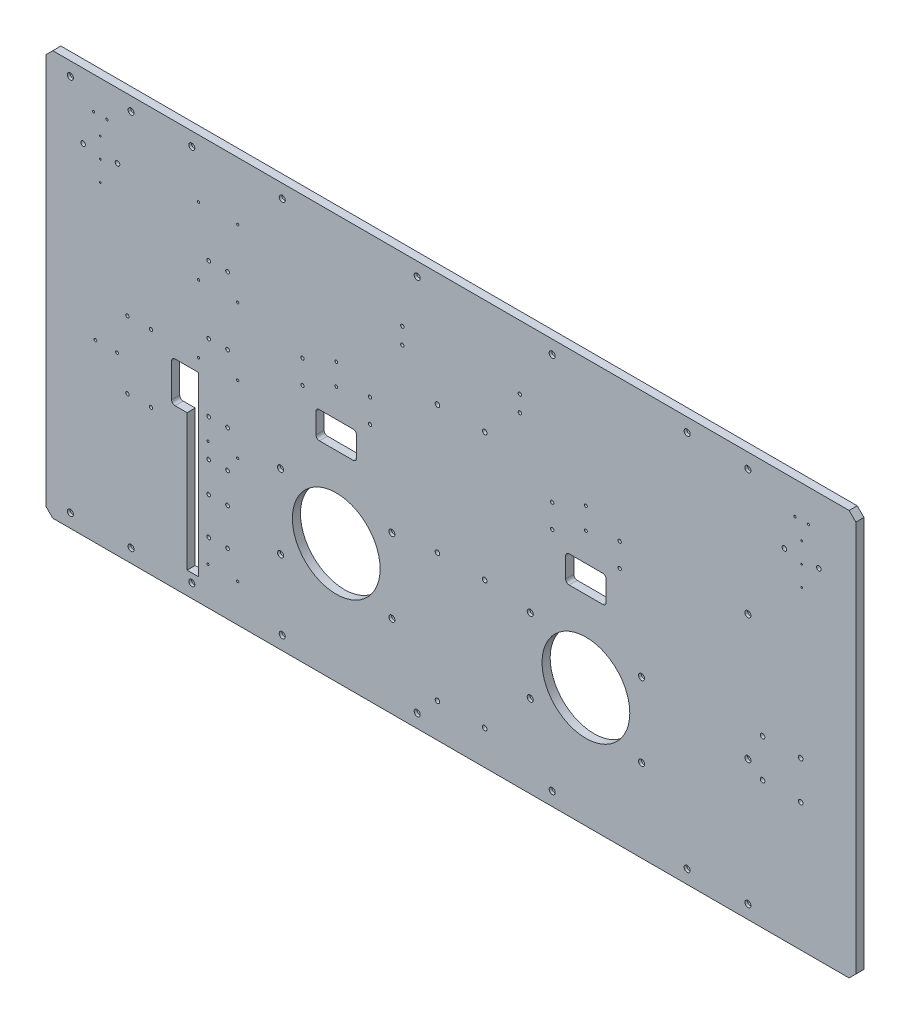
from build123d import *

# Parameters (mm, degrees)
BOSS_EXTRUDE1_DEPTH                             = 6
CUT_EXTRUDE1_REACH                              = 672.928
SKETCH2_R                                       = 65
BOSS_EXTRUDE2_DEPTH                             = 12
M8X1_25_TAPPED_HOLE1_D                          = 6.8
M4X0_7_TAPPED_HOLE1_D                           = 3.3
M6X1_0_TAPPED_HOLE1_D                           = 5
CBORE_FOR_M8_PAN_HEAD_SCREW1_D                  = 9
CBORE_FOR_M8_PAN_HEAD_SCREW1_CBORE_D            = 14
CBORE_FOR_M8_PAN_HEAD_SCREW1_CBORE_DEPTH        = 8
CBORE_FOR_M5_PAN_HEAD_SCREW1_D                  = 5.5
CBORE_FOR_M5_PAN_HEAD_SCREW1_CBORE_D            = 9.5
CBORE_FOR_M5_PAN_HEAD_SCREW1_CBORE_DEPTH        = 5
SKETCH21_W                                      = 17
SKETCH21_H                                      = 262.1
CUT_EXTRUDE2_DEPTH                              = 671.927715928
CBORE_FOR_M8_SOCKET_HEAD_CAP_SCREW2_D           = 9
CBORE_FOR_M8_SOCKET_HEAD_CAP_SCREW2_CBORE_D     = 15
CBORE_FOR_M8_SOCKET_HEAD_CAP_SCREW2_CBORE_DEPTH = 8
LPATTERN1_COUNT                                 = 2
LPATTERN1_PITCH                                 = 560
CBORE_FOR_M8_SOCKET_HEAD_CAP_SCREW3_D           = 9
CBORE_FOR_M8_SOCKET_HEAD_CAP_SCREW3_CBORE_D     = 15
CBORE_FOR_M8_SOCKET_HEAD_CAP_SCREW3_CBORE_DEPTH = 8
LPATTERN2_COUNT                                 = 4
LPATTERN2_PITCH                                 = 200
MIRROR1_COPY_1_D                                = 9
MIRROR1_COPY_1_CBORE_D                          = 15
MIRROR1_COPY_1_CBORE_DEPTH                      = 8
MIRROR1_COPY_2_D                                = 9
MIRROR1_COPY_2_CBORE_D                          = 15
MIRROR1_COPY_2_CBORE_DEPTH                      = 8
MIRROR1_COPY_3_D                                = 9
MIRROR1_COPY_3_CBORE_D                          = 15
MIRROR1_COPY_3_CBORE_DEPTH                      = 8
CBORE_FOR_M8_SOCKET_HEAD_CAP_SCREW4_D           = 9
CBORE_FOR_M8_SOCKET_HEAD_CAP_SCREW4_CBORE_D     = 15
CBORE_FOR_M8_SOCKET_HEAD_CAP_SCREW4_CBORE_DEPTH = 8
LPATTERN3_COUNT                                 = 4
LPATTERN3_PITCH                                 = 186
M3X0_5_TAPPED_HOLE1_D                           = 2.5
LPATTERN4_COUNT                                 = 3
LPATTERN4_PITCH                                 = 30
M5X0_8_TAPPED_HOLE1_D                           = 4.2
M8X1_25_TAPPED_HOLE2_D                          = 6.8
SKETCH45_W                                      = 5.088141025
SKETCH45_H                                      = 1.356837607
SKETCH45_W_2                                    = 5.088141026
CUT_EXTRUDE3_DEPTH                              = 0.01


with BuildPart() as part:
    # Sketch1 → Boss-Extrude1 (new, symmetric)
    with BuildSketch(Plane.XY):
        Polygon((-600, 290), (-590, 300), (590, 300), (600, 290), (600, -290), (590, -300), (-590, -300), (-600, -290), align=None)
    extrude(amount=BOSS_EXTRUDE1_DEPTH, both=True)

    # Sketch2 → Cut-Extrude1 (cut, up to next)
    with BuildSketch(Plane.XY.offset(6), mode=Mode.PRIVATE) as cut_extrude1_sk1:
        with Locations((-170, -122.5)):
            Circle(SKETCH2_R)
    cut_extrude1_tool1 = extrude(cut_extrude1_sk1.sketch, amount=-CUT_EXTRUDE1_REACH, mode=Mode.PRIVATE) & part.part
    # Sketch2 → Cut-Extrude1 (cut, up to next)
    with BuildSketch(Plane.XY.offset(6), mode=Mode.PRIVATE) as cut_extrude1_sk2:
        with Locations((200, -122.5)):
            Circle(SKETCH2_R)
    cut_extrude1_tool2 = extrude(cut_extrude1_sk2.sketch, amount=-CUT_EXTRUDE1_REACH, mode=Mode.PRIVATE) & part.part
    # Sketch2 → Cut-Extrude1 (cut, up to next)
    with BuildSketch(Plane.XY.offset(6), mode=Mode.PRIVATE) as cut_extrude1_sk3:
        with BuildLine():
            Line((-323.99999995, 230), (-303.99999995, 230))
            Line((-303.99999995, 230), (-303.99999995, -20))
            Line((-303.99999995, -20), (-318.99999995, -20))
            ThreePointArc((-318.99999995, -20), (-322.535533856, -18.535533906), (-323.99999995, -15))
            Line((-323.99999995, -15), (-323.99999995, 230))
        make_face()
    cut_extrude1_tool3 = extrude(cut_extrude1_sk3.sketch, amount=-CUT_EXTRUDE1_REACH, mode=Mode.PRIVATE) & part.part
    # Sketch2 → Cut-Extrude1 (cut, up to next)
    with BuildSketch(Plane.XY.offset(6), mode=Mode.PRIVATE) as cut_extrude1_sk4:
        with BuildLine():
            Line((175, 36.9), (225, 36.9))
            ThreePointArc((225, 36.9), (228.535533906, 35.435533906), (230, 31.9))
            Line((230, 31.9), (230, 1.9))
            ThreePointArc((230, 1.9), (228.535533906, -1.635533906), (225, -3.1))
            Line((225, -3.1), (175, -3.1))
            ThreePointArc((175, -3.1), (171.464466094, -1.635533906), (170, 1.9))
            Line((170, 1.9), (170, 31.9))
            ThreePointArc((170, 31.9), (171.464466094, 35.435533906), (175, 36.9))
        make_face()
    cut_extrude1_tool4 = extrude(cut_extrude1_sk4.sketch, amount=-CUT_EXTRUDE1_REACH, mode=Mode.PRIVATE) & part.part
    # Sketch2 → Cut-Extrude1 (cut, up to next)
    with BuildSketch(Plane.XY.offset(6), mode=Mode.PRIVATE) as cut_extrude1_sk5:
        with BuildLine():
            Line((-408.9, -5), (-385, -5))
            ThreePointArc((-385, -5), (-381.464466094, -6.464466094), (-380, -10))
            Line((-380, -10), (-380, -60))
            ThreePointArc((-380, -60), (-381.464466094, -63.535533906), (-385, -65))
            Line((-385, -65), (-408.9, -65))
            ThreePointArc((-408.9, -65), (-412.435533906, -63.535533906), (-413.9, -60))
            Line((-413.9, -60), (-413.9, -10))
            ThreePointArc((-413.9, -10), (-412.435533906, -6.464466094), (-408.9, -5))
        make_face()
    cut_extrude1_tool5 = extrude(cut_extrude1_sk5.sketch, amount=-CUT_EXTRUDE1_REACH, mode=Mode.PRIVATE) & part.part
    # Sketch2 → Cut-Extrude1 (cut, up to next)
    with BuildSketch(Plane.XY.offset(6), mode=Mode.PRIVATE) as cut_extrude1_sk6:
        with BuildLine():
            Line((-200, 31.9), (-200, 1.9))
            ThreePointArc((-200, 1.9), (-198.535533906, -1.635533906), (-195, -3.1))
            Line((-195, -3.1), (-145, -3.1))
            ThreePointArc((-145, -3.1), (-141.464466094, -1.635533906), (-140, 1.9))
            Line((-140, 1.9), (-140, 31.9))
            ThreePointArc((-140, 31.9), (-141.464466094, 35.435533906), (-145, 36.9))
            Line((-145, 36.9), (-195, 36.9))
            ThreePointArc((-195, 36.9), (-198.535533906, 35.435533906), (-200, 31.9))
        make_face()
    cut_extrude1_tool6 = extrude(cut_extrude1_sk6.sketch, amount=-CUT_EXTRUDE1_REACH, mode=Mode.PRIVATE) & part.part
    add(cut_extrude1_tool1.solids().sort_by_distance((-170, -122.5, 6))[0], mode=Mode.SUBTRACT)
    add(cut_extrude1_tool2.solids().sort_by_distance((200, -122.5, 6))[0], mode=Mode.SUBTRACT)
    add(cut_extrude1_tool3.solids().sort_by_distance((-313.990458, 105.133071, 6))[0], mode=Mode.SUBTRACT)
    add(cut_extrude1_tool4.solids().sort_by_distance((200, 16.9, 6))[0], mode=Mode.SUBTRACT)
    add(cut_extrude1_tool5.solids().sort_by_distance((-396.95, -35, 6))[0], mode=Mode.SUBTRACT)
    add(cut_extrude1_tool6.solids().sort_by_distance((-170, 16.9, 6))[0], mode=Mode.SUBTRACT)

    # Sketch20 → Boss-Extrude2 (add)
    with BuildSketch(Plane.XY.offset(6)):
        with BuildLine():
            Line((-303.99999995, -20), (-303.99999995, 230))
            Line((-303.99999995, 230), (-323.99999995, 230))
            Line((-323.99999995, 230), (-323.99999995, -15))
            ThreePointArc((-323.99999995, -15), (-322.535533856, -18.535533906), (-318.99999995, -20))
            Line((-318.99999995, -20), (-303.99999995, -20))
        make_face()
    extrude(amount=-BOSS_EXTRUDE2_DEPTH)

    # M8x1.25 Tapped Hole1 (through all)
    with Locations(Plane.XY.offset(6)):
        with Locations((-20, 130.77), (50, 130.77), (50, -59.23), (-20, -59.23), (-20, -249.23), (50, -249.23), (-494.1, 203.3), (-545.1, 203.3), (545.1, 203.3), (494.1, 203.3)):
            Hole(M8X1_25_TAPPED_HOLE1_D / 2)

    # M4x0.7 Tapped Hole1 (through all)
    with Locations(Plane(origin=(0, 0, -6), x_dir=(-1, 0, 0), z_dir=(0, 0, -1))):
        with Locations((-529.6, 251.9), (-509.6, 251.9), (509.6, 251.9), (529.6, 251.9), (316, -244), (360, -244.1), (374, 213.9), (316, 213.9), (316, -86.1), (360, -86.1), (316, 13.9), (374, 13.9), (374, 113.9), (316, 113.9)):
            Hole(M4X0_7_TAPPED_HOLE1_D / 2)

    # M6x1.0 Tapped Hole1 (through all)
    with Locations(Plane(origin=(0, 0, -6), x_dir=(-1, 0, 0), z_dir=(0, 0, -1))):
        with Locations((-102.1, 205.3), (120, 90.5), (120, 55.5), (220, 90.5), (220, 55.5), (-150, 90.5), (-150, 55.5), (-250, 55.5), (-250, 90.5), (479.4, -85), (479.4, 15), (444.4, 15), (444.4, -85), (72.1, 205.3), (-102.1, 181.3), (72.1, 181.3)):
            Hole(M6X1_0_TAPPED_HOLE1_D / 2)

    # CBORE for M8 Pan Head Screw1 (through all)
    with Locations(Plane(origin=(0, 0, -6), x_dir=(-1, 0, 0), z_dir=(0, 0, -1))):
        with Locations((-282.5, -177.5), (-117.5, -177.5), (-117.5, -67.5), (-282.5, -67.5), (87.5, -67.5), (252.5, -177.5), (252.5, -67.5), (87.5, -177.5)):
            CounterBoreHole(CBORE_FOR_M8_PAN_HEAD_SCREW1_D / 2, CBORE_FOR_M8_PAN_HEAD_SCREW1_CBORE_D / 2, CBORE_FOR_M8_PAN_HEAD_SCREW1_CBORE_DEPTH)

    # CBORE for M5 Pan Head Screw1 (through all)
    with Locations(Plane(origin=(0, 0, -6), x_dir=(-1, 0, 0), z_dir=(0, 0, -1))):
        with Locations((331, -209.1), (331, -154.1), (331, -54.1), (331, 45.9), (331, 145.9), (359, -209.1), (359, -154.1), (359, -54.1), (359, 45.9), (359, 145.9), (331, -109.1), (359, -109.1)):
            CounterBoreHole(CBORE_FOR_M5_PAN_HEAD_SCREW1_D / 2, CBORE_FOR_M5_PAN_HEAD_SCREW1_CBORE_D / 2, CBORE_FOR_M5_PAN_HEAD_SCREW1_CBORE_DEPTH)

    # Sketch21 → Cut-Extrude2 (cut, through all)
    with BuildSketch(Plane(origin=(0, 0, -6), x_dir=(-1, 0, 0), z_dir=(0, 0, -1))):
        with Locations((382.5, -136.05)):
            Rectangle(SKETCH21_W, SKETCH21_H)
    extrude(amount=-CUT_EXTRUDE2_DEPTH, mode=Mode.SUBTRACT)

    # CBORE for M8 Socket Head Cap Screw2 (through all)
    with Locations(Plane(origin=(0, 0, -6), x_dir=(-1, 0, 0), z_dir=(0, 0, -1))):
        with Locations((564, -280), (474, -280), (384, -280)):
            cbore_for_m8_socket_head_cap_screw2 = CounterBoreHole(CBORE_FOR_M8_SOCKET_HEAD_CAP_SCREW2_D / 2, CBORE_FOR_M8_SOCKET_HEAD_CAP_SCREW2_CBORE_D / 2, CBORE_FOR_M8_SOCKET_HEAD_CAP_SCREW2_CBORE_DEPTH)

    # LPattern1: CBORE for M8 Socket Head Cap Screw2 ×2
    with Locations(*[(0, i * LPATTERN1_PITCH, 0) for i in range(1, LPATTERN1_COUNT)]):
        add(cbore_for_m8_socket_head_cap_screw2, mode=Mode.SUBTRACT)

    # CBORE for M8 Socket Head Cap Screw3 (through all)
    with Locations(Plane(origin=(0, 0, -6), x_dir=(-1, 0, 0), z_dir=(0, 0, -1))):
        with Locations((250, -280)):
            cbore_for_m8_socket_head_cap_screw3 = CounterBoreHole(CBORE_FOR_M8_SOCKET_HEAD_CAP_SCREW3_D / 2, CBORE_FOR_M8_SOCKET_HEAD_CAP_SCREW3_CBORE_D / 2, CBORE_FOR_M8_SOCKET_HEAD_CAP_SCREW3_CBORE_DEPTH)

    # LPattern2: CBORE for M8 Socket Head Cap Screw3 ×4
    with Locations(*[(i * LPATTERN2_PITCH, 0, 0) for i in range(1, LPATTERN2_COUNT)]):
        add(cbore_for_m8_socket_head_cap_screw3, mode=Mode.SUBTRACT)

    # Mirror1: CBORE for M8 Socket Head Cap Screw3 across plane
    add(cbore_for_m8_socket_head_cap_screw3.mirror(Plane.ZX), mode=Mode.SUBTRACT)

    # Mirror1 copy 1 (through all)
    with Locations(Plane(origin=(200, 0, -6), x_dir=(-1, 0, 0), z_dir=(0, 0, -1))):
        with Locations((250, 280)):
            CounterBoreHole(MIRROR1_COPY_1_D / 2, MIRROR1_COPY_1_CBORE_D / 2, MIRROR1_COPY_1_CBORE_DEPTH)

    # Mirror1 copy 2 (through all)
    with Locations(Plane(origin=(400, 0, -6), x_dir=(-1, 0, 0), z_dir=(0, 0, -1))):
        with Locations((250, 280)):
            CounterBoreHole(MIRROR1_COPY_2_D / 2, MIRROR1_COPY_2_CBORE_D / 2, MIRROR1_COPY_2_CBORE_DEPTH)

    # Mirror1 copy 3 (through all)
    with Locations(Plane(origin=(600, 0, -6), x_dir=(-1, 0, 0), z_dir=(0, 0, -1))):
        with Locations((250, 280)):
            CounterBoreHole(MIRROR1_COPY_3_D / 2, MIRROR1_COPY_3_CBORE_D / 2, MIRROR1_COPY_3_CBORE_DEPTH)

    # CBORE for M8 Socket Head Cap Screw4 (through all)
    with Locations(Plane(origin=(0, 0, -6), x_dir=(-1, 0, 0), z_dir=(0, 0, -1))):
        with Locations((-440, -280)):
            cbore_for_m8_socket_head_cap_screw4 = CounterBoreHole(CBORE_FOR_M8_SOCKET_HEAD_CAP_SCREW4_D / 2, CBORE_FOR_M8_SOCKET_HEAD_CAP_SCREW4_CBORE_D / 2, CBORE_FOR_M8_SOCKET_HEAD_CAP_SCREW4_CBORE_DEPTH)

    # LPattern3: CBORE for M8 Socket Head Cap Screw4 ×4
    with Locations(*[(0, i * LPATTERN3_PITCH, 0) for i in range(1, LPATTERN3_COUNT)]):
        add(cbore_for_m8_socket_head_cap_screw4, mode=Mode.SUBTRACT)

    # M3x0.5 Tapped Hole1 (through all)
    with Locations(Plane(origin=(0, 0, -6), x_dir=(-1, 0, 0), z_dir=(0, 0, -1))):
        with Locations((519.6, 225.9), (-519.6, 225.9)):
            m3x0_5_tapped_hole1 = Hole(M3X0_5_TAPPED_HOLE1_D / 2)

    # LPattern4: M3x0.5 Tapped Hole1 ×3
    with Locations(*[(0, -i * LPATTERN4_PITCH, 0) for i in range(1, LPATTERN4_COUNT)]):
        add(m3x0_5_tapped_hole1, mode=Mode.SUBTRACT)

    # M5x0.8 Tapped Hole1 (through all)
    with Locations(Plane(origin=(0, 0, -6), x_dir=(-1, 0, 0), z_dir=(0, 0, -1))):
        with Locations((494.843466521, -39.859868954), (526.843466521, -39.859868954), (-200, 111), (-200, 79), (170, 111), (170, 79)):
            Hole(M5X0_8_TAPPED_HOLE1_D / 2)

    # M8x1.25 Tapped Hole2 (through all)
    with Locations(Plane(origin=(0, 0, -6), x_dir=(-1, 0, 0), z_dir=(0, 0, -1))):
        with Locations((-518.284271247, -110.284271247), (-461.715728753, -53.715728753), (-461.715728753, -110.284271247), (-518.284271247, -53.715728753)):
            Hole(M8X1_25_TAPPED_HOLE2_D / 2)

    # Sketch45 → Cut-Extrude3 (cut)
    # profile 1 of 14: a face of its own
    with BuildSketch(Plane(origin=(0, 0, -6), x_dir=(-1, 0, 0), z_dir=(0, 0, -1))):
        Polygon((-119.904833666, -276.437594854), (-119.904833666, -275.080757247), (-112.951040931, -275.080757247), (-112.951040931, -276.437594854), (-115.834320845, -276.437594854), (-115.834320845, -288.309923914), (-117.021553751, -288.309923914), (-117.021553751, -276.437594854), align=None)
    # profile 2 of 14: a face of its own
    with BuildSketch(Plane(origin=(0, 0, -6), x_dir=(-1, 0, 0), z_dir=(0, 0, -1))):
        with BuildLine():
            Line((-98.534641358, -277.338619828), (-99.552269563, -278.303246564))
            add(Edge.make_bspline(
                [(-99.552269563, -278.303246564), (-99.73641536, -278.130016814), (-100.100315893, -277.787688076), (-100.693588239, -277.343524493), (-101.312575784, -276.963030602), (-101.954048615, -276.65344453), (-102.602121125, -276.406426656), (-103.248191202, -276.230561364), (-103.885631799, -276.118406237), (-104.309597178, -276.104994246), (-104.51850721, -276.098385453)],
                knots=[0, 0, 0, 0, 1.08915593, 2.152340314, 3.188132944, 4.216796309, 5.218260357, 6.173443236, 7.099959455, 8, 8, 8, 8], degree=3))
            add(Edge.make_bspline(
                [(-104.51850721, -276.098385453), (-104.646696701, -276.099948784), (-104.902743217, -276.103071393), (-105.283070208, -276.142926017), (-105.65940839, -276.200245592), (-106.031047336, -276.283180665), (-106.398709639, -276.388292289), (-106.761116583, -276.519773058), (-107.118944203, -276.673062225), (-107.46882195, -276.850191218), (-107.808019687, -277.044772781), (-108.128380345, -277.260402681), (-108.431945871, -277.490169833), (-108.713010573, -277.739826809), (-108.97319119, -278.007112163), (-109.218680572, -278.287053826), (-109.440844756, -278.587300039), (-109.641516718, -278.902326661), (-109.820532359, -279.22660071), (-109.978559115, -279.557000999), (-110.111217752, -279.892431639), (-110.216179681, -280.233313539), (-110.302776498, -280.577009519), (-110.363697216, -280.925899385), (-110.398042862, -281.280356708), (-110.403983816, -281.517715393), (-110.406970418, -281.637038965)],
                knots=[0, 0, 0, 0, 1.02818874, 2.053710826, 3.065248034, 4.081641283, 5.106893873, 6.131558223, 7.173050175, 8.228653731, 9.27666206, 10.308777013, 11.325269123, 12.329503258, 13.32196095, 14.316845687, 15.314881793, 16.315733098, 17.311955233, 18.285320748, 19.252783886, 20.203351036, 21.145449891, 22.095197417, 23.042428769, 24, 24, 24, 24], degree=3))
            add(Edge.make_bspline(
                [(-110.406970418, -281.637038965), (-110.404113983, -281.75901497), (-110.398408912, -282.002633906), (-110.361895204, -282.366224597), (-110.294130724, -282.724415255), (-110.203538491, -283.0783829), (-110.090218146, -283.428733748), (-109.948958367, -283.77394889), (-109.781644936, -284.114015547), (-109.587982969, -284.445869635), (-109.375612497, -284.7691263), (-109.137702638, -285.073622112), (-108.884985551, -285.363411835), (-108.608254442, -285.6320613), (-108.316382958, -285.886756384), (-108.000650843, -286.120479934), (-107.667266543, -286.337733933), (-107.315721427, -286.535780301), (-106.949829958, -286.712705421), (-106.574663063, -286.870033837), (-106.189022213, -286.999601571), (-105.79493407, -287.105200952), (-105.39286843, -287.191758623), (-104.980784414, -287.247443891), (-104.561711975, -287.287852686), (-104.27921774, -287.290807213), (-104.136896633, -287.292295709)],
                knots=[0, 0, 0, 0, 0.93586088, 1.869166235, 2.799637598, 3.729985548, 4.670839027, 5.622275134, 6.589130586, 7.576015415, 8.568469353, 9.55398029, 10.53834874, 11.515998671, 12.510579167, 13.508179873, 14.527009472, 15.561807829, 16.601455013, 17.643573243, 18.680854198, 19.719860599, 20.772568776, 21.833555941, 22.908541556, 24, 24, 24, 24], degree=3))
            add(Edge.make_bspline(
                [(-104.136896633, -287.292295709), (-103.965377285, -287.288710316), (-103.628571179, -287.281669815), (-103.133473612, -287.226862174), (-102.657967958, -287.141262686), (-102.203390345, -287.015903493), (-101.769212796, -286.856005674), (-101.353843643, -286.663255255), (-100.960553147, -286.430259169), (-100.588159009, -286.167286516), (-100.245118457, -285.874298905), (-99.935729357, -285.55814278), (-99.664926466, -285.220352766), (-99.428673585, -284.86291839), (-99.233227183, -284.482881076), (-99.072803523, -284.082103236), (-98.949835427, -283.660404605), (-98.899356802, -283.369016592), (-98.87385076, -283.221782888)],
                knots=[0, 0, 0, 0, 1.13008108, 2.219097802, 3.278683437, 4.311054135, 5.322181354, 6.324827112, 7.324222904, 8.330512327, 9.32562643, 10.293043162, 11.24128371, 12.174520618, 13.111833804, 14.052305215, 15.015860969, 16, 16, 16, 16], degree=3))
            Line((-98.87385076, -283.221782888), (-103.283572982, -283.221782888))
            Line((-103.283572982, -283.221782888), (-103.283572982, -281.864945282))
            Line((-103.283572982, -281.864945282), (-97.686617854, -281.864945282))
            add(Edge.make_bspline(
                [(-97.686617854, -281.864945282), (-97.693065554, -282.117839659), (-97.705684869, -282.612799638), (-97.794202795, -283.334621793), (-97.937140207, -284.016383848), (-98.132403886, -284.658803791), (-98.385176523, -285.26097124), (-98.692745306, -285.82349758), (-99.060032787, -286.342748725), (-99.473956182, -286.822963708), (-99.938488761, -287.251321147), (-100.441078485, -287.627807877), (-100.982555717, -287.944939786), (-101.562408263, -288.202948838), (-102.178737877, -288.404311854), (-102.832970741, -288.547079421), (-103.524219649, -288.632615294), (-103.997962445, -288.64354402), (-104.240249498, -288.649133316)],
                knots=[0, 0, 0, 0, 1.140356446, 2.231883559, 3.274166699, 4.278491846, 5.25512956, 6.21435461, 7.1637429, 8.11826594, 9.068280886, 10.0076534, 10.945064095, 11.891975133, 12.864533718, 13.863980011, 14.907571808, 16, 16, 16, 16], degree=3))
            add(Edge.make_bspline(
                [(-104.240249498, -288.649133316), (-104.389588402, -288.646982173), (-104.684132853, -288.642739426), (-105.119149158, -288.612586952), (-105.542171117, -288.566169298), (-105.953137103, -288.496073147), (-106.353558813, -288.410217162), (-106.741436411, -288.300276291), (-107.11824746, -288.173016623), (-107.48457437, -288.028268096), (-107.837092151, -287.860553798), (-108.17737095, -287.674175101), (-108.507291723, -287.470093053), (-108.824607138, -287.244778249), (-109.130970529, -286.999915974), (-109.424406462, -286.735015447), (-109.706557667, -286.450886513), (-109.883301086, -286.249126566), (-109.972358372, -286.147463978)],
                knots=[0, 0, 0, 0, 1.107784379, 2.184907829, 3.233506516, 4.263428166, 5.276301166, 6.270063455, 7.25232949, 8.225834625, 9.190232166, 10.146266622, 11.1027726, 12.066435141, 13.031522626, 14.010570082, 14.99756817, 16, 16, 16, 16], degree=3))
            add(Edge.make_bspline(
                [(-109.972358372, -286.147463978), (-110.101573055, -285.98617907), (-110.357857591, -285.666286415), (-110.687748242, -285.153750911), (-110.96896783, -284.623065309), (-111.197143825, -284.072752279), (-111.375314568, -283.503326564), (-111.503094154, -282.91551579), (-111.577960991, -282.30856302), (-111.588746683, -281.897834192), (-111.594203324, -281.690040434)],
                knots=[0, 0, 0, 0, 1.023165419, 2.029347347, 3.013907458, 3.994755782, 4.975994455, 5.96558838, 6.970761222, 8, 8, 8, 8], degree=3))
            add(Edge.make_bspline(
                [(-111.594203324, -281.690040434), (-111.59219159, -281.5344418), (-111.588193691, -281.225222096), (-111.539716294, -280.766142393), (-111.470163315, -280.315214181), (-111.367931889, -279.872806067), (-111.239056126, -279.43862258), (-111.078214081, -279.012462121), (-110.89094617, -278.594073202), (-110.673286706, -278.186335665), (-110.431062707, -277.794660057), (-110.168179434, -277.420623122), (-109.880903921, -277.071036477), (-109.573927536, -276.741472807), (-109.243587722, -276.436072403), (-108.892979186, -276.152007759), (-108.521831729, -275.88889783), (-108.128977716, -275.650886848), (-107.720280813, -275.43708983), (-107.296720689, -275.249654416), (-106.858426638, -275.094747242), (-106.408682303, -274.963310634), (-105.944083417, -274.866113526), (-105.468001477, -274.795625708), (-104.977954923, -274.74739368), (-104.646711597, -274.743514677), (-104.478756108, -274.741547846)],
                knots=[0, 0, 0, 0, 1.008945113, 2.00506715, 2.99143336, 3.967273523, 4.948097931, 5.927297278, 6.919902385, 7.919676788, 8.923139349, 9.905703106, 10.883022732, 11.856032218, 12.825136022, 13.798837087, 14.781400844, 15.773989409, 16.776158564, 17.77167057, 18.775803737, 19.789618931, 20.80898985, 21.851988756, 22.910860228, 24, 24, 24, 24], degree=3))
            add(Edge.make_bspline(
                [(-104.478756108, -274.741547846), (-104.341784175, -274.743738187), (-104.070184928, -274.748081375), (-103.666031119, -274.778185848), (-103.268124188, -274.825901113), (-102.875874143, -274.891014265), (-102.490616747, -274.979701429), (-102.111254497, -275.085830659), (-101.737237471, -275.209397965), (-101.369737838, -275.356766521), (-101.006284566, -275.524034686), (-100.644856776, -275.712317563), (-100.286689388, -275.924834693), (-99.931161274, -276.162217104), (-99.576030502, -276.420387761), (-99.226914145, -276.706730517), (-98.875385159, -277.009953434), (-98.64934854, -277.227978355), (-98.534641358, -277.338619828)],
                knots=[0, 0, 0, 0, 0.985871117, 1.954866573, 2.915460327, 3.869826059, 4.81536089, 5.759505086, 6.70452669, 7.649098992, 8.607881297, 9.583363685, 10.581137262, 11.603961102, 12.659522466, 13.73993555, 14.853081303, 16, 16, 16, 16], degree=3))
        make_face()
    # profile 3 of 14: a face of its own
    with BuildSketch(Plane(origin=(0, 0, -6), x_dir=(-1, 0, 0), z_dir=(0, 0, -1))):
        Polygon((-95.651361443, -288.309923914), (-93.904963039, -275.080757247), (-93.735358338, -275.080757247), (-88.273556956, -285.935458102), (-82.825005941, -275.080757247), (-82.652751167, -275.080757247), (-80.895752469, -288.309923914), (-82.088285522, -288.309923914), (-83.355020631, -278.790860079), (-88.13045299, -288.309923914), (-88.398110408, -288.309923914), (-93.192093281, -278.769659491), (-94.456178317, -288.309923914), align=None)
    # profile 4 of 14: a face of its own
    with BuildSketch(Plane(origin=(0, 0, -6), x_dir=(-1, 0, 0), z_dir=(0, 0, -1))):
        with Locations((-76.825239649, -283.221782889)):
            Rectangle(SKETCH45_W, SKETCH45_H)
    # profile 5 of 14: a face of its own
    with BuildSketch(Plane(origin=(0, 0, -6), x_dir=(-1, 0, 0), z_dir=(0, 0, -1))):
        with BuildLine():
            add(Edge.make_bspline(
                [(-73.263540931, -281.700640728), (-73.2623011, -281.488605959), (-73.259892711, -281.076725363), (-73.233100168, -280.476557222), (-73.188592178, -279.913522797), (-73.12759675, -279.387595136), (-73.053369861, -278.898638467), (-72.954281563, -278.447959474), (-72.841596268, -278.03347227), (-72.710996249, -277.653825242), (-72.56363169, -277.303903567), (-72.403240288, -276.977236883), (-72.22345669, -276.674319461), (-72.034555858, -276.390316503), (-71.828891182, -276.129876942), (-71.612315397, -275.889322831), (-71.376375567, -275.674213744), (-71.129092173, -275.478247066), (-70.86822637, -275.306458884), (-70.601213912, -275.155144664), (-70.326216934, -275.025877308), (-70.042484636, -274.924237863), (-69.752567229, -274.840286151), (-69.455451233, -274.782875545), (-69.150646078, -274.746752706), (-68.944908214, -274.74329926), (-68.840568341, -274.741547846)],
                knots=[0, 0, 0, 0, 1.646270934, 3.197905019, 4.663502075, 6.030701355, 7.308322542, 8.50163776, 9.611534131, 10.641858119, 11.616356847, 12.558055219, 13.465016945, 14.349605745, 15.204443733, 16.039544428, 16.859896111, 17.680448484, 18.487036065, 19.28249412, 20.06191084, 20.843045899, 21.620316918, 22.403196591, 23.190181807, 24, 24, 24, 24], degree=3))
            add(Edge.make_bspline(
                [(-68.840568341, -274.741547846), (-68.73535686, -274.743391671), (-68.526124326, -274.747058459), (-68.216787194, -274.782300742), (-67.914596432, -274.840777904), (-67.620840372, -274.923633968), (-67.333106049, -275.026427151), (-67.053644032, -275.155268338), (-66.780718455, -275.305245009), (-66.518666476, -275.481472164), (-66.264611233, -275.677952791), (-66.02479304, -275.900061688), (-65.799190066, -276.145556163), (-65.584970906, -276.411809637), (-65.388213143, -276.703928856), (-65.200837372, -277.016833081), (-65.033121641, -277.355994385), (-64.871594744, -277.715753892), (-64.732170717, -278.106065935), (-64.60643223, -278.524730357), (-64.504836129, -278.976692314), (-64.42021001, -279.459580503), (-64.354650433, -279.975168311), (-64.306902054, -280.522350516), (-64.281679381, -281.101487111), (-64.27692935, -281.497446839), (-64.274491785, -281.700640728)],
                knots=[0, 0, 0, 0, 0.810914788, 1.612654377, 2.396697861, 3.181598691, 3.963628158, 4.749916497, 5.551656086, 6.361998678, 7.18212741, 8.025565596, 8.878627764, 9.750805457, 10.657531673, 11.591944965, 12.560506719, 13.57287815, 14.630710178, 15.753379473, 16.941251878, 18.199788006, 19.531962791, 20.947069417, 22.433333509, 24, 24, 24, 24], degree=3))
            add(Edge.make_bspline(
                [(-64.274491785, -281.700640728), (-64.27695462, -281.902948356), (-64.281753352, -282.297136519), (-64.306619297, -282.873667289), (-64.355599838, -283.417945607), (-64.416869734, -283.93127682), (-64.501729029, -284.411524367), (-64.606069984, -284.86035011), (-64.721920907, -285.279692285), (-64.864927421, -285.666115532), (-65.021450046, -286.025010437), (-65.19174796, -286.360151146), (-65.37419641, -286.674499931), (-65.572969345, -286.965540641), (-65.784837901, -287.23533497), (-66.014336686, -287.479120627), (-66.254996338, -287.702771679), (-66.509799219, -287.901782294), (-66.775938118, -288.075971883), (-67.047926296, -288.231750425), (-67.330589679, -288.3573621), (-67.617522566, -288.46521776), (-67.912829188, -288.547618278), (-68.216141438, -288.604593863), (-68.525916497, -288.644552933), (-68.735321222, -288.647601235), (-68.840568341, -288.649133316)],
                knots=[0, 0, 0, 0, 1.561518951, 3.042555995, 4.452378317, 5.7783523, 7.031515105, 8.214008947, 9.334062868, 10.386615937, 11.391082383, 12.354592575, 13.286541444, 14.194233754, 15.072674879, 15.931287219, 16.775624067, 17.606195743, 18.42308326, 19.229000347, 20.022332153, 20.807536673, 21.593273796, 22.3848459, 23.188221202, 24, 24, 24, 24], degree=3))
            add(Edge.make_bspline(
                [(-68.840568341, -288.649133316), (-68.94490532, -288.647370603), (-69.150637476, -288.643894878), (-69.455484441, -288.607935238), (-69.751373438, -288.550121878), (-70.039764562, -288.469172214), (-70.322137402, -288.370086374), (-70.5946442, -288.240993582), (-70.860314909, -288.092320166), (-71.118440731, -287.923004139), (-71.36417122, -287.729020396), (-71.598889163, -287.5144649), (-71.816698015, -287.273983554), (-72.019422127, -287.011373547), (-72.212092043, -286.729050875), (-72.38932271, -286.423160894), (-72.553254212, -286.094916503), (-72.703097168, -285.742197019), (-72.835950747, -285.359855476), (-72.953303692, -284.943517807), (-73.04596137, -284.489509302), (-73.125271946, -284.001476396), (-73.189242084, -283.477321957), (-73.232914682, -282.916761426), (-73.259907153, -282.320144119), (-73.262307568, -281.910910151), (-73.263540931, -281.700640728)],
                knots=[0, 0, 0, 0, 0.810891512, 1.598919785, 2.382837074, 3.152667961, 3.926044502, 4.706494248, 5.493654104, 6.291793342, 7.103789334, 7.925228297, 8.761435821, 9.622817696, 10.50288917, 11.416980706, 12.369136599, 13.353924996, 14.394355917, 15.514179734, 16.714354668, 17.994756427, 19.357759367, 20.818452758, 22.365282078, 24, 24, 24, 24], degree=3))
        make_face()
        with BuildLine():
            add(Edge.make_bspline(
                [(-72.076308025, -281.695340581), (-72.075856543, -281.872039532), (-72.074980306, -282.214977499), (-72.05208931, -282.713313634), (-72.020905397, -283.178112198), (-71.980683828, -283.609963363), (-71.920952445, -284.007405374), (-71.854025003, -284.373171736), (-71.772578355, -284.705326769), (-71.676213257, -285.006149744), (-71.566452385, -285.280745925), (-71.446611769, -285.536262423), (-71.317870347, -285.775717659), (-71.173789033, -285.996960762), (-71.016871979, -286.200713228), (-70.850663529, -286.390581374), (-70.668960607, -286.559903297), (-70.417592294, -286.762978017), (-70.085742525, -286.972827124), (-69.667623542, -287.155563832), (-69.237983861, -287.270402284), (-68.946370505, -287.285006361), (-68.800817239, -287.292295709)],
                knots=[0, 0, 0, 0, 1.459021318, 2.831673884, 4.118529203, 5.306027144, 6.411944654, 7.436330062, 8.375795394, 9.233974572, 10.042671642, 10.816086306, 11.563610507, 12.285937304, 12.993564865, 13.685989202, 14.367179055, 15.041617293, 16.353048772, 17.594441528, 18.799311195, 20, 20, 20, 20], degree=3))
            add(Edge.make_bspline(
                [(-68.800817239, -287.292295709), (-68.654322468, -287.286256478), (-68.361635384, -287.274190485), (-67.934016575, -287.15777859), (-67.518884304, -286.982134795), (-67.193552863, -286.774446308), (-66.94604444, -286.576657681), (-66.768709388, -286.408024933), (-66.605945098, -286.219203649), (-66.451571779, -286.015477144), (-66.309985392, -285.792953171), (-66.181234841, -285.55270177), (-66.063747189, -285.29405577), (-65.996811211, -285.11349753), (-65.962588573, -285.021182762)],
                knots=[0, 0, 0, 0, 1.353760809, 2.704726607, 4.075137775, 5.516104923, 6.260822281, 7.007110065, 7.778089737, 8.566572457, 9.372053459, 10.217411131, 11.088608312, 12, 12, 12, 12], degree=3))
            add(Edge.make_bspline(
                [(-65.962588573, -285.021182762), (-65.922705404, -284.903141782), (-65.841725464, -284.663467971), (-65.737359532, -284.291676786), (-65.6551671, -283.90159491), (-65.581222236, -283.495553546), (-65.530750864, -283.070558248), (-65.490126689, -282.627923999), (-65.466198199, -282.167317065), (-65.463232027, -281.854371711), (-65.461724691, -281.695340581)],
                knots=[0, 0, 0, 0, 0.884706709, 1.796334032, 2.740027952, 3.714592787, 4.726048262, 5.777819803, 6.87074269, 8, 8, 8, 8], degree=3))
            add(Edge.make_bspline(
                [(-65.461724691, -281.695340581), (-65.463804276, -281.536335173), (-65.467872387, -281.225286603), (-65.483422281, -280.769756575), (-65.523576863, -280.337095693), (-65.568174723, -279.925440038), (-65.633932077, -279.537068358), (-65.704832121, -279.168729406), (-65.800086703, -278.824986426), (-65.901837043, -278.50045765), (-66.018293002, -278.198830176), (-66.146486402, -277.918697709), (-66.283396026, -277.658707827), (-66.432100328, -277.419573852), (-66.590834011, -277.200224657), (-66.763786652, -277.005058183), (-66.944097823, -276.828025595), (-67.196650877, -276.625949813), (-67.527282865, -276.419908583), (-67.938693496, -276.230293955), (-68.366829562, -276.121405468), (-68.656258987, -276.106053258), (-68.800817239, -276.098385453)],
                knots=[0, 0, 0, 0, 1.31362396, 2.569729283, 3.763502607, 4.902122613, 5.988968491, 7.01645872, 7.998833611, 8.933434873, 9.825090667, 10.667526885, 11.477055099, 12.250526234, 12.991942729, 13.710640831, 14.402115721, 15.076753259, 16.378508321, 17.609869233, 18.806226677, 20, 20, 20, 20], degree=3))
            add(Edge.make_bspline(
                [(-68.800817239, -276.098385453), (-68.947134061, -276.106063837), (-69.240034257, -276.121434595), (-69.672620277, -276.229888262), (-70.087276606, -276.418925365), (-70.417034278, -276.626632249), (-70.669763471, -276.824458605), (-70.847724842, -276.996008595), (-71.014586862, -277.183659616), (-71.168301086, -277.389285901), (-71.312269507, -277.610271069), (-71.444489406, -277.848353602), (-71.563617408, -278.104740009), (-71.67355003, -278.379212845), (-71.77020908, -278.680009867), (-71.849939238, -279.011755766), (-71.923595659, -279.37635875), (-71.975738491, -279.775953318), (-72.022092568, -280.207912648), (-72.051882187, -280.673871559), (-72.07505688, -281.173043473), (-72.075882624, -281.517754578), (-72.076308025, -281.695340581)],
                knots=[0, 0, 0, 0, 1.207732386, 2.417664972, 3.655092373, 4.956220595, 5.625982001, 6.301752483, 6.994047911, 7.697131622, 8.419323945, 9.170223765, 9.943494443, 10.752040957, 11.610060368, 12.549350801, 13.567764191, 14.679664412, 15.874934091, 17.154273443, 18.533957287, 20, 20, 20, 20], degree=3))
        make_face(mode=Mode.SUBTRACT)
    # profile 6 of 14: a face of its own
    with BuildSketch(Plane(origin=(0, 0, -6), x_dir=(-1, 0, 0), z_dir=(0, 0, -1))):
        with BuildLine():
            Line((-61.391211871, -278.133641863), (-62.578444777, -278.133641863))
            add(Edge.make_bspline(
                [(-62.578444777, -278.133641863), (-62.546280701, -278.000471462), (-62.483402564, -277.740134221), (-62.352253998, -277.368178205), (-62.209381813, -277.016193467), (-62.037821805, -276.690770807), (-61.850690502, -276.385370193), (-61.63629212, -276.106918443), (-61.404518168, -275.848333722), (-61.148156009, -275.618852139), (-60.879306603, -275.411049413), (-60.594181701, -275.233872857), (-60.298517788, -275.08145716), (-59.990266362, -274.955892593), (-59.668509702, -274.861302072), (-59.336156661, -274.79267367), (-58.992336289, -274.748106066), (-58.758945098, -274.743756455), (-58.640435629, -274.741547846)],
                knots=[0, 0, 0, 0, 1.162005537, 2.271625781, 3.343758855, 4.383309926, 5.390229558, 6.379919256, 7.361854164, 8.333198761, 9.295911338, 10.242430842, 11.177959212, 12.116337295, 13.062827104, 14.020064771, 14.994644689, 16, 16, 16, 16], degree=3))
            add(Edge.make_bspline(
                [(-58.640435629, -274.741547846), (-58.467765741, -274.746761008), (-58.126192396, -274.757073617), (-57.624379688, -274.851244255), (-57.140468795, -275.000261869), (-56.679756459, -275.206159587), (-56.251817741, -275.460111634), (-55.87105894, -275.7623593), (-55.542641057, -276.107070946), (-55.267117665, -276.487816055), (-55.051387758, -276.894728248), (-54.892311287, -277.313526461), (-54.795467433, -277.743217246), (-54.782916519, -278.033341486), (-54.776628537, -278.178693111)],
                knots=[0, 0, 0, 0, 1.083050992, 2.142477498, 3.193116406, 4.255571735, 5.30263384, 6.308962982, 7.297363603, 8.282367274, 9.249857812, 10.179914175, 11.08814088, 12, 12, 12, 12], degree=3))
            add(Edge.make_bspline(
                [(-54.776628537, -278.178693111), (-54.781026635, -278.318569984), (-54.789633028, -278.592287318), (-54.862709832, -278.991889406), (-54.985689159, -279.36851093), (-55.15604213, -279.723737347), (-55.376559299, -280.055316354), (-55.643685267, -280.363993978), (-55.959305447, -280.651139307), (-56.198484766, -280.815632554), (-56.321621359, -280.900318546)],
                knots=[0, 0, 0, 0, 1.024540389, 2.004866551, 2.965041327, 3.920577974, 4.882998113, 5.874504559, 6.905732034, 8, 8, 8, 8], degree=3))
            add(Edge.make_bspline(
                [(-56.321621359, -280.900318546), (-56.180894192, -280.968271753), (-55.90207297, -281.102906712), (-55.522015909, -281.366944843), (-55.177007273, -281.671806632), (-54.984603336, -281.909714874), (-54.887931622, -282.029249836)],
                knots=[0, 0, 0, 0, 1.015518401, 2.012035669, 3.001164323, 4, 4, 4, 4], degree=3))
            add(Edge.make_bspline(
                [(-54.887931622, -282.029249836), (-54.824275358, -282.116402647), (-54.698005245, -282.289281081), (-54.542144745, -282.567231263), (-54.4007472, -282.848262189), (-54.290566312, -283.139906373), (-54.20524247, -283.438783538), (-54.14425211, -283.74540688), (-54.106363244, -284.060026786), (-54.100937199, -284.272874554), (-54.098209734, -284.379864986)],
                knots=[0, 0, 0, 0, 1.025084078, 2.033381695, 3.024893161, 4.013698104, 4.991890475, 5.976764909, 6.982997093, 8, 8, 8, 8], degree=3))
            add(Edge.make_bspline(
                [(-54.098209734, -284.379864986), (-54.104992568, -284.565110064), (-54.118526315, -284.934728452), (-54.239494096, -285.480808501), (-54.427020333, -286.014607274), (-54.693330776, -286.525158006), (-55.017889515, -287.002845755), (-55.404019877, -287.430247281), (-55.847334575, -287.797634862), (-56.341748784, -288.104590189), (-56.877405787, -288.349964478), (-57.450325436, -288.520270884), (-58.052252723, -288.631191776), (-58.465030306, -288.643086191), (-58.674886584, -288.649133316)],
                knots=[0, 0, 0, 0, 0.955779014, 1.907060117, 2.875433937, 3.871313158, 4.872415639, 5.851225146, 6.836215519, 7.83643374, 8.849228613, 9.86973379, 10.916971861, 12, 12, 12, 12], degree=3))
            add(Edge.make_bspline(
                [(-58.674886584, -288.649133316), (-58.816322629, -288.645851676), (-59.094621604, -288.639394504), (-59.503756255, -288.595252172), (-59.894287679, -288.514629831), (-60.266743897, -288.406138171), (-60.62145579, -288.268586051), (-60.95734095, -288.097292162), (-61.276465845, -287.895787378), (-61.575819023, -287.661693162), (-61.8553648, -287.399826193), (-62.107674204, -287.105537673), (-62.336953779, -286.784267724), (-62.537064348, -286.432284744), (-62.717120686, -286.054137492), (-62.865215374, -285.644983941), (-62.995562612, -285.208481834), (-63.05616529, -284.904295138), (-63.087258879, -284.748225196)],
                knots=[0, 0, 0, 0, 1.048658725, 2.063410685, 3.046034179, 4.001477787, 4.936774919, 5.862367409, 6.792675028, 7.730719943, 8.675894397, 9.627829632, 10.600096036, 11.597688215, 12.626045268, 13.701542398, 14.82072376, 16, 16, 16, 16], degree=3))
            Line((-63.087258879, -284.748225196), (-61.900025973, -284.748225196))
            add(Edge.make_bspline(
                [(-61.900025973, -284.748225196), (-61.86909508, -284.85008605), (-61.808931806, -285.048214258), (-61.70652181, -285.333360652), (-61.589847092, -285.594761627), (-61.464681944, -285.834334736), (-61.333227699, -286.054439353), (-61.186138547, -286.249255346), (-61.034308743, -286.427339592), (-60.919859997, -286.527671905), (-60.863847254, -286.576775877)],
                knots=[0, 0, 0, 0, 1.198163088, 2.33053128, 3.407730985, 4.417276592, 5.372219308, 6.28897303, 7.162600585, 8, 8, 8, 8], degree=3))
            add(Edge.make_bspline(
                [(-60.863847254, -286.576775877), (-60.789776861, -286.633881782), (-60.641864712, -286.747917319), (-60.400835982, -286.893444308), (-60.14734668, -287.01954104), (-59.87590431, -287.115863343), (-59.592366339, -287.197421763), (-59.292149809, -287.250793963), (-58.977903364, -287.287412944), (-58.763334734, -287.290644382), (-58.653685996, -287.292295709)],
                knots=[0, 0, 0, 0, 0.946170439, 1.889420265, 2.845303464, 3.807233317, 4.801018734, 5.828864929, 6.890507805, 8, 8, 8, 8], degree=3))
            add(Edge.make_bspline(
                [(-58.653685996, -287.292295709), (-58.529885554, -287.289967734), (-58.287804478, -287.285415579), (-57.934567361, -287.243552044), (-57.598518378, -287.182582922), (-57.283388569, -287.088417779), (-56.985050044, -286.972073489), (-56.707684881, -286.825991719), (-56.447651979, -286.654599467), (-56.208281905, -286.459793719), (-55.993041445, -286.246533901), (-55.803526023, -286.023478543), (-55.642414951, -285.791568116), (-55.512453212, -285.549519266), (-55.409830597, -285.298334323), (-55.339968499, -285.037308391), (-55.291392832, -284.768577653), (-55.287436887, -284.585905657), (-55.28544264, -284.493818145)],
                knots=[0, 0, 0, 0, 1.217147791, 2.380027433, 3.494444702, 4.572153297, 5.609568379, 6.639424714, 7.649109417, 8.668170816, 9.669597737, 10.625200337, 11.543417969, 12.441394052, 13.322311151, 14.205496177, 15.095365482, 16, 16, 16, 16], degree=3))
            add(Edge.make_bspline(
                [(-55.28544264, -284.493818145), (-55.291226815, -284.370555049), (-55.302766385, -284.124642196), (-55.390867266, -283.762852555), (-55.535779044, -283.414270014), (-55.738648358, -283.084841879), (-55.985601856, -282.779528203), (-56.274243022, -282.50711516), (-56.606968766, -282.282332375), (-56.91320458, -282.127027037), (-57.184459785, -282.021053568), (-57.416595315, -281.950466649), (-57.676478905, -281.890694796), (-57.960967784, -281.835085912), (-58.272205536, -281.787758197), (-58.609853323, -281.74829062), (-58.973979564, -281.716710555), (-59.226056293, -281.702607903), (-59.35595546, -281.695340581)],
                knots=[0, 0, 0, 0, 1.07054697, 2.135767047, 3.216561865, 4.33974944, 5.486079747, 6.621378074, 7.775625952, 8.963672916, 9.598146892, 10.304877434, 11.070270905, 11.915000392, 12.823868403, 13.805723172, 14.86925407, 16, 16, 16, 16], degree=3))
            Line((-59.35595546, -281.695340581), (-59.35595546, -280.338502974))
            add(Edge.make_bspline(
                [(-59.35595546, -280.338502974), (-59.192287364, -280.335725591), (-58.871701768, -280.33028538), (-58.403410795, -280.264487245), (-57.955609883, -280.173468204), (-57.53822309, -280.03405096), (-57.157794918, -279.872124838), (-56.827747612, -279.683695355), (-56.552705121, -279.474240797), (-56.334004047, -279.240528256), (-56.169473927, -278.989873166), (-56.049176211, -278.728628656), (-55.978115454, -278.454504973), (-55.96862951, -278.267426913), (-55.963861443, -278.173392965)],
                knots=[0, 0, 0, 0, 1.321986639, 2.589447074, 3.816329219, 5.01088745, 6.139805852, 7.153945165, 8.075214402, 8.924034688, 9.728124013, 10.488707548, 11.240355623, 12, 12, 12, 12], degree=3))
            add(Edge.make_bspline(
                [(-55.963861443, -278.173392965), (-55.965427818, -278.10430744), (-55.968544046, -277.966865065), (-56.007843281, -277.766064954), (-56.066898436, -277.57140364), (-56.148086698, -277.383708941), (-56.256755604, -277.204282608), (-56.386802041, -277.031594929), (-56.541651706, -276.866631836), (-56.719094318, -276.712869914), (-56.909638938, -276.566331428), (-57.118469933, -276.441925717), (-57.33929071, -276.335544083), (-57.572345744, -276.247817691), (-57.81839135, -276.181825739), (-58.076271494, -276.134443243), (-58.346477916, -276.104818774), (-58.530823451, -276.100553631), (-58.624535188, -276.098385453)],
                knots=[0, 0, 0, 0, 0.884392785, 1.759457502, 2.611959086, 3.489218968, 4.37281399, 5.2945488, 6.255912374, 7.266815255, 8.301784654, 9.332968512, 10.37626691, 11.440494194, 12.520033166, 13.637162961, 14.798855837, 16, 16, 16, 16], degree=3))
            add(Edge.make_bspline(
                [(-58.624535188, -276.098385453), (-58.775165005, -276.10364447), (-59.06938007, -276.113916553), (-59.493525738, -276.203886277), (-59.887827983, -276.34743439), (-60.189221157, -276.51878241), (-60.411783268, -276.687928395), (-60.570824076, -276.83565051), (-60.727005767, -276.999816242), (-60.870053415, -277.190536887), (-61.014719934, -277.394896481), (-61.14642408, -277.62328361), (-61.274405655, -277.869740696), (-61.351522434, -278.043971219), (-61.391211871, -278.133641863)],
                knots=[0, 0, 0, 0, 1.472543308, 2.876219568, 4.221790263, 5.565193594, 6.249813518, 6.953379497, 7.687249741, 8.463570142, 9.283606569, 10.136032583, 11.040678096, 12, 12, 12, 12], degree=3))
        make_face()
    # profile 7 of 14: a face of its own
    with BuildSketch(Plane(origin=(0, 0, -6), x_dir=(-1, 0, 0), z_dir=(0, 0, -1))):
        with Locations((-50.366906315, -283.221782889)):
            Rectangle(SKETCH45_W_2, SKETCH45_H)
    # profile 8 of 14: a face of its own
    with BuildSketch(Plane(origin=(0, 0, -6), x_dir=(-1, 0, 0), z_dir=(0, 0, -1))):
        Polygon((-43.993479666, -275.080757247), (-41.547461871, -275.080757247), (-41.547461871, -288.309923914), (-42.734694777, -288.309923914), (-42.734694777, -276.437594854), (-44.769951187, -276.437594854), align=None)
    # profile 9 of 14: a face of its own
    with BuildSketch(Plane(origin=(0, 0, -6), x_dir=(-1, 0, 0), z_dir=(0, 0, -1))):
        Polygon((-29.407475392, -274.741547846), (-29.166318708, -274.741547846), (-29.166318708, -283.900201692), (-27.639876401, -283.900201692), (-27.639876401, -285.257039299), (-29.166318708, -285.257039299), (-29.166318708, -288.309923914), (-30.353551614, -288.309923914), (-30.353551614, -285.257039299), (-36.628925546, -285.257039299), align=None)
        Polygon((-30.353551614, -283.900201692), (-30.353551614, -278.15484245), (-34.296860909, -283.900201692), align=None, mode=Mode.SUBTRACT)
    # profile 10 of 14: a face of its own
    with BuildSketch(Plane(origin=(0, 0, -6), x_dir=(-1, 0, 0), z_dir=(0, 0, -1))):
        with BuildLine():
            Line((-18.142013153, -275.080757247), (-18.142013153, -276.437594854))
            Line((-18.142013153, -276.437594854), (-22.641837872, -276.437594854))
            Line((-22.641837872, -276.437594854), (-23.354707631, -279.917141295))
            add(Edge.make_bspline(
                [(-23.354707631, -279.917141295), (-23.214645248, -279.878473304), (-22.943296535, -279.803560185), (-22.542793489, -279.720383613), (-22.16257891, -279.670243393), (-21.915853552, -279.66339707), (-21.796464442, -279.660084171)],
                knots=[0, 0, 0, 0, 1.100273476, 2.13160584, 3.095893838, 4, 4, 4, 4], degree=3))
            add(Edge.make_bspline(
                [(-21.796464442, -279.660084171), (-21.648737211, -279.663281606), (-21.358268566, -279.669568563), (-20.933276118, -279.729938351), (-20.527583337, -279.824961243), (-20.142038664, -279.957708453), (-19.775928845, -280.127456552), (-19.432622288, -280.339500969), (-19.106965891, -280.587201358), (-18.804801919, -280.871987564), (-18.530677302, -281.185411532), (-18.289657044, -281.522407056), (-18.084935348, -281.879699112), (-17.920286066, -282.260701413), (-17.788809565, -282.661201785), (-17.701300537, -283.085414225), (-17.643029047, -283.529340155), (-17.636518837, -283.832872309), (-17.63319905, -283.987654116)],
                knots=[0, 0, 0, 0, 1.052922333, 2.070308379, 3.05430497, 4.020497103, 4.973039431, 5.925935799, 6.892292201, 7.88610001, 8.88166317, 9.857072816, 10.836096531, 11.812156883, 12.81219415, 13.836441305, 14.89672472, 16, 16, 16, 16], degree=3))
            add(Edge.make_bspline(
                [(-17.63319905, -283.987654116), (-17.635712876, -284.095461318), (-17.640706557, -284.3096188), (-17.666101218, -284.627663845), (-17.714995145, -284.938975744), (-17.780641007, -285.243595796), (-17.86584598, -285.540947292), (-17.968992106, -285.831881341), (-18.095221139, -286.114587146), (-18.233679015, -286.391739681), (-18.389580882, -286.657073324), (-18.56261274, -286.905210863), (-18.745422781, -287.139874665), (-18.942126827, -287.358548001), (-19.154553208, -287.559793932), (-19.380129273, -287.744806781), (-19.617055026, -287.916715381), (-19.868995972, -288.068541595), (-20.130338095, -288.208252769), (-20.404855463, -288.32286852), (-20.686299182, -288.425339861), (-20.978719992, -288.50701873), (-21.281455534, -288.571019755), (-21.595004834, -288.614489287), (-21.917723438, -288.646150226), (-22.136477206, -288.64813217), (-22.246976928, -288.649133316)],
                knots=[0, 0, 0, 0, 1.056347294, 2.098418968, 3.122841568, 4.141288669, 5.149314143, 6.15115421, 7.162517403, 8.180376062, 9.185164535, 10.17417709, 11.141909838, 12.097768115, 13.052685741, 14.0056014, 14.954263652, 15.917497458, 16.885230207, 17.854509472, 18.828990115, 19.81800267, 20.826176721, 21.857883937, 22.917946725, 24, 24, 24, 24], degree=3))
            add(Edge.make_bspline(
                [(-22.246976928, -288.649133316), (-22.378793028, -288.646522113), (-22.638125632, -288.641384879), (-23.018069442, -288.58764239), (-23.383627624, -288.510671635), (-23.731857471, -288.394873829), (-24.065879807, -288.249778995), (-24.381197818, -288.066399418), (-24.685868459, -287.858591496), (-24.967506217, -287.61335921), (-25.22889986, -287.345314816), (-25.462891724, -287.054433256), (-25.671283517, -286.745515424), (-25.850738097, -286.417061092), (-26.003810975, -286.069933311), (-26.124064056, -285.702831493), (-26.221122123, -285.31767374), (-26.262183266, -285.052510173), (-26.283038794, -284.917829897)],
                knots=[0, 0, 0, 0, 1.0467383, 2.05933395, 3.04377827, 4.011590433, 4.970194871, 5.932262533, 6.905835911, 7.896367577, 8.894135286, 9.877477877, 10.858688626, 11.851381753, 12.8477658, 13.868841284, 14.917554742, 16, 16, 16, 16], degree=3))
            Line((-26.283038794, -284.917829897), (-25.095805888, -284.917829897))
            add(Edge.make_bspline(
                [(-25.095805888, -284.917829897), (-25.066593781, -285.04398494), (-25.01044649, -285.286461939), (-24.887204523, -285.627136949), (-24.736521005, -285.930724491), (-24.557343855, -286.201240476), (-24.343598204, -286.437131626), (-24.099692327, -286.647350878), (-23.826235159, -286.83700092), (-23.522367892, -286.995081023), (-23.201794646, -287.129900418), (-22.866275727, -287.21967617), (-22.524946799, -287.282801568), (-22.294085102, -287.289120426), (-22.178075018, -287.292295709)],
                knots=[0, 0, 0, 0, 1.136247022, 2.183929868, 3.172523383, 4.106158343, 5.02341133, 5.958108904, 6.928429099, 7.938127109, 8.96079061, 9.975095812, 10.982467395, 12, 12, 12, 12], degree=3))
            add(Edge.make_bspline(
                [(-22.178075018, -287.292295709), (-22.064839232, -287.289193364), (-21.841877041, -287.283084821), (-21.513750668, -287.236068317), (-21.196957959, -287.163657259), (-20.894624795, -287.055292033), (-20.601460643, -286.923587294), (-20.324881213, -286.754574954), (-20.056885219, -286.560068336), (-19.80580269, -286.337226312), (-19.575844058, -286.091656335), (-19.372658719, -285.829048331), (-19.203412647, -285.548904297), (-19.0607867, -285.256074226), (-18.952484053, -284.947348727), (-18.875222011, -284.624174642), (-18.829853306, -284.285753735), (-18.823612239, -284.054926284), (-18.820431956, -283.93730272)],
                knots=[0, 0, 0, 0, 1.027316725, 2.022795036, 3.002884548, 3.971462791, 4.93288096, 5.914575861, 6.907176829, 7.935150275, 8.956128384, 9.956726525, 10.942570165, 11.921478529, 12.907843606, 13.90538589, 14.932640048, 16, 16, 16, 16], degree=3))
            add(Edge.make_bspline(
                [(-18.820431956, -283.93730272), (-18.822920852, -283.831183064), (-18.827792511, -283.623468935), (-18.867595559, -283.319579078), (-18.936829354, -283.032041091), (-19.032925566, -282.759466456), (-19.15493442, -282.501598088), (-19.304032089, -282.258169854), (-19.483016658, -282.032390187), (-19.687471118, -281.824153452), (-19.911452404, -281.631971931), (-20.158814169, -281.468141604), (-20.424379964, -281.330316677), (-20.704950176, -281.211375136), (-21.007198453, -281.125949699), (-21.325139296, -281.061815132), (-21.66220602, -281.024715398), (-21.892660704, -281.019567784), (-22.011120391, -281.016921777)],
                knots=[0, 0, 0, 0, 1.045622112, 2.046656509, 3.013763289, 3.955457236, 4.890082067, 5.820317437, 6.762574623, 7.722996705, 8.69280354, 9.665887285, 10.63943826, 11.638615906, 12.663482002, 13.728887084, 14.832589034, 16, 16, 16, 16], degree=3))
            add(Edge.make_bspline(
                [(-22.011120391, -281.016921777), (-22.113661283, -281.019116274), (-22.325382209, -281.023647352), (-22.650150036, -281.057009408), (-22.991431251, -281.110830551), (-23.347917588, -281.184861903), (-23.720679628, -281.281741271), (-24.108930726, -281.39783477), (-24.51348721, -281.536635182), (-24.786075037, -281.641456347), (-24.926201187, -281.695340581)],
                knots=[0, 0, 0, 0, 0.817624296, 1.688186739, 2.600797293, 3.572016777, 4.590301741, 5.671205678, 6.80286297, 8, 8, 8, 8], degree=3))
            Line((-24.926201187, -281.695340581), (-23.56936358, -275.080757247))
            Line((-23.56936358, -275.080757247), (-18.142013153, -275.080757247))
        make_face()
    # profile 11 of 14: a face of its own
    with BuildSketch(Plane(origin=(0, 0, -6), x_dir=(-1, 0, 0), z_dir=(0, 0, -1))):
        with BuildLine():
            Line((-15.089128537, -275.080757247), (-12.507956996, -275.080757247))
            add(Edge.make_bspline(
                [(-12.507956996, -275.080757247), (-12.381605308, -275.081421542), (-12.13670429, -275.082709111), (-11.780577233, -275.102678088), (-11.44701774, -275.129906245), (-11.135929077, -275.173109274), (-10.847454993, -275.225238908), (-10.580726126, -275.288367796), (-10.336590654, -275.364063628), (-10.04512287, -275.484434988), (-9.712803706, -275.663305297), (-9.352976448, -275.927618624), (-9.045287805, -276.250910969), (-8.780000237, -276.615592435), (-8.569085291, -277.016760382), (-8.416498958, -277.444853149), (-8.319896275, -277.894349019), (-8.309961419, -278.202940792), (-8.304940503, -278.358898106)],
                knots=[0, 0, 0, 0, 1.001505555, 1.941167018, 2.826882275, 3.653841531, 4.429895133, 5.150066043, 5.825578002, 6.45369114, 7.647487171, 8.808567382, 9.977351308, 11.170798116, 12.373658725, 13.556498008, 14.765093433, 16, 16, 16, 16], degree=3))
            add(Edge.make_bspline(
                [(-8.304940503, -278.358898106), (-8.309072609, -278.504995564), (-8.317192585, -278.792090845), (-8.394839325, -279.212000127), (-8.516398994, -279.611714556), (-8.685374192, -279.989775358), (-8.904985904, -280.337640503), (-9.165253953, -280.658116181), (-9.479264487, -280.937633569), (-9.714529114, -281.093899897), (-9.834032884, -281.173276111)],
                knots=[0, 0, 0, 0, 1.044552857, 2.05264487, 3.044412934, 4.028983338, 5.005914585, 5.980388656, 6.974128949, 8, 8, 8, 8], degree=3))
            add(Edge.make_bspline(
                [(-9.834032884, -281.173276111), (-9.683747935, -281.230974172), (-9.396215598, -281.341364857), (-9.000527396, -281.536534617), (-8.659612357, -281.748814022), (-8.370849335, -281.980633813), (-8.123888556, -282.230509377), (-7.908242021, -282.502104601), (-7.724238017, -282.798962406), (-7.566573098, -283.117987673), (-7.44354655, -283.455922837), (-7.351411435, -283.809598091), (-7.298617803, -284.17774522), (-7.291104992, -284.428288171), (-7.287312298, -284.554769834)],
                knots=[0, 0, 0, 0, 1.27268992, 2.434971085, 3.483601985, 4.442670788, 5.356604649, 6.2567628, 7.179492994, 8.113709626, 9.066344395, 10.018646069, 10.999752585, 12, 12, 12, 12], degree=3))
            add(Edge.make_bspline(
                [(-7.287312298, -284.554769834), (-7.291004543, -284.683912476), (-7.29826914, -284.938004241), (-7.351866057, -285.311275137), (-7.442614765, -285.667989965), (-7.567615824, -286.010455983), (-7.730759097, -286.338010658), (-7.929302295, -286.651025078), (-8.166034693, -286.946354244), (-8.430855656, -287.227279844), (-8.730447694, -287.479872968), (-9.053676887, -287.704828169), (-9.40461387, -287.88983263), (-9.777494919, -288.045241402), (-10.176502899, -288.163953134), (-10.599846088, -288.247004232), (-11.047159372, -288.302963747), (-11.354112895, -288.307564492), (-11.511529379, -288.309923914)],
                knots=[0, 0, 0, 0, 0.978564426, 1.925352924, 2.850884081, 3.763762016, 4.682927383, 5.618979971, 6.567305752, 7.547517671, 8.540179244, 9.531824382, 10.526200242, 11.540722885, 12.589160233, 13.674978461, 14.80764778, 16, 16, 16, 16], degree=3))
            Line((-11.511529379, -288.309923914), (-15.089128537, -288.309923914))
            Line((-15.089128537, -288.309923914), (-15.089128537, -275.080757247))
        make_face()
        with BuildLine():
            Line((-13.901895631, -276.437594854), (-13.901895631, -280.677712376))
            Line((-13.901895631, -280.677712376), (-13.104223523, -280.677712376))
            add(Edge.make_bspline(
                [(-13.104223523, -280.677712376), (-12.987622421, -280.676200762), (-12.762325331, -280.673280016), (-12.436056675, -280.664913449), (-12.133203183, -280.64148632), (-11.854287624, -280.618065925), (-11.599749219, -280.579986382), (-11.370151886, -280.534659013), (-11.161892308, -280.486720651), (-10.921727954, -280.405193127), (-10.649309369, -280.284703104), (-10.358898529, -280.097711343), (-10.102878361, -279.874991317), (-9.88668661, -279.61800167), (-9.709750397, -279.335025313), (-9.586856295, -279.030577283), (-9.50352281, -278.712245236), (-9.495995296, -278.493706007), (-9.492173409, -278.382748767)],
                knots=[0, 0, 0, 0, 1.156816544, 2.235205308, 3.236616184, 4.169592532, 5.011045266, 5.787822928, 6.49130361, 7.128639758, 8.301311294, 9.436451833, 10.541879658, 11.654887649, 12.756523258, 13.837046038, 14.901820046, 16, 16, 16, 16], degree=3))
            add(Edge.make_bspline(
                [(-9.492173409, -278.382748767), (-9.494162245, -278.309323976), (-9.498063564, -278.16529323), (-9.530015035, -277.955329898), (-9.584321045, -277.757860952), (-9.65407388, -277.570180238), (-9.751548983, -277.39815628), (-9.866315645, -277.235841225), (-10.00497882, -277.088762682), (-10.162811519, -276.951294637), (-10.344272683, -276.829418), (-10.549254054, -276.722674639), (-10.780528905, -276.636719917), (-11.034199517, -276.561441603), (-11.314170592, -276.508569183), (-11.617211315, -276.464522152), (-11.945803854, -276.4420978), (-12.173138021, -276.439129315), (-12.290650973, -276.437594854)],
                knots=[0, 0, 0, 0, 0.91205012, 1.789085906, 2.630437955, 3.453916878, 4.269457761, 5.079663411, 5.91843418, 6.774407191, 7.675494373, 8.627863946, 9.638891023, 10.736472738, 11.911756761, 13.175263542, 14.539845004, 16, 16, 16, 16], degree=3))
            Line((-12.290650973, -276.437594854), (-13.901895631, -276.437594854))
        make_face(mode=Mode.SUBTRACT)
        with BuildLine():
            Line((-13.901895631, -282.034549982), (-13.901895631, -286.953086307))
            Line((-13.901895631, -286.953086307), (-12.21114877, -286.953086307))
            add(Edge.make_bspline(
                [(-12.21114877, -286.953086307), (-12.090124853, -286.951635833), (-11.856867209, -286.948840236), (-11.520085774, -286.939713795), (-11.207941304, -286.918954301), (-10.921858172, -286.886275047), (-10.658747235, -286.850826743), (-10.421764846, -286.803159103), (-10.208989978, -286.748545473), (-9.962268636, -286.664127619), (-9.684442875, -286.53298322), (-9.385044698, -286.3352479), (-9.118850362, -286.099680636), (-8.892800721, -285.827042954), (-8.707543294, -285.530591213), (-8.572774163, -285.216321586), (-8.489653961, -284.889426884), (-8.479591595, -284.666546751), (-8.474545204, -284.554769834)],
                knots=[0, 0, 0, 0, 1.160039823, 2.235823828, 3.228722157, 4.157150951, 4.99529583, 5.772374946, 6.472645482, 7.099169577, 8.269452708, 9.405989375, 10.527446681, 11.663510218, 12.788923519, 13.866172445, 14.929861265, 16, 16, 16, 16], degree=3))
            add(Edge.make_bspline(
                [(-8.474545204, -284.554769834), (-8.475588813, -284.48486941), (-8.477659197, -284.346196062), (-8.508882354, -284.142407103), (-8.554291922, -283.945005737), (-8.612997044, -283.753455944), (-8.698493244, -283.571220861), (-8.798303697, -283.394696305), (-8.915330423, -283.223648928), (-9.097681883, -283.007400231), (-9.362915277, -282.758249617), (-9.739783149, -282.514313225), (-10.168303442, -282.317584906), (-10.479103787, -282.234054147), (-10.639655213, -282.190904316)],
                knots=[0, 0, 0, 0, 0.723448775, 1.435228256, 2.130040452, 2.821711965, 3.505591119, 4.210454504, 4.921174351, 5.648778258, 7.137944449, 8.670945889, 10.280296675, 12, 12, 12, 12], degree=3))
            add(Edge.make_bspline(
                [(-10.639655213, -282.190904316), (-10.704021141, -282.177844921), (-10.843579749, -282.14952946), (-11.071150068, -282.119640224), (-11.330955287, -282.093011575), (-11.623595329, -282.07331464), (-11.949440442, -282.052954788), (-12.309186534, -282.045036862), (-12.701364479, -282.035590254), (-12.973478506, -282.03490561), (-13.114823817, -282.034549982)],
                knots=[0, 0, 0, 0, 0.634451884, 1.375622551, 2.216452059, 3.157844607, 4.20941857, 5.370758133, 6.634282058, 8, 8, 8, 8], degree=3))
            Line((-13.114823817, -282.034549982), (-13.901895631, -282.034549982))
        make_face(mode=Mode.SUBTRACT)
    # profile 12 of 14: a face of its own
    with BuildSketch(Plane(origin=(0, 0, -6), x_dir=(-1, 0, 0), z_dir=(0, 0, -1))):
        with Locations((-3.216799478, -283.221782889)):
            Rectangle(SKETCH45_W, SKETCH45_H)
    # profile 13 of 14: a face of its own
    with BuildSketch(Plane(origin=(0, 0, -6), x_dir=(-1, 0, 0), z_dir=(0, 0, -1))):
        with BuildLine():
            add(Edge.make_bspline(
                [(0.34489924, -281.700640728), (0.346139071, -281.488605959), (0.34854746, -281.076725363), (0.375340003, -280.476557222), (0.419847993, -279.913522797), (0.48084342, -279.387595136), (0.55507031, -278.898638467), (0.654158608, -278.447959474), (0.766843903, -278.03347227), (0.897443922, -277.653825242), (1.044808481, -277.303903567), (1.205199883, -276.977236883), (1.384983481, -276.674319461), (1.573884313, -276.390316503), (1.779548988, -276.129876942), (1.996124774, -275.889322831), (2.232064604, -275.674213744), (2.479347998, -275.478247066), (2.740213801, -275.306458884), (3.007226259, -275.155144664), (3.282223237, -275.025877308), (3.565955535, -274.924237863), (3.855872942, -274.840286151), (4.152988938, -274.782875545), (4.457794093, -274.746752706), (4.663531957, -274.74329926), (4.76787183, -274.741547846)],
                knots=[0, 0, 0, 0, 1.646270934, 3.197905019, 4.663502075, 6.030701355, 7.308322542, 8.50163776, 9.611534131, 10.641858119, 11.616356847, 12.558055219, 13.465016945, 14.349605745, 15.204443733, 16.039544428, 16.859896111, 17.680448484, 18.487036065, 19.28249412, 20.06191084, 20.843045899, 21.620316918, 22.403196591, 23.190181807, 24, 24, 24, 24], degree=3))
            add(Edge.make_bspline(
                [(4.76787183, -274.741547846), (4.873083311, -274.743391671), (5.082315845, -274.747058459), (5.391652977, -274.782300742), (5.693843739, -274.840777904), (5.987599798, -274.923633968), (6.275334122, -275.026427151), (6.554796139, -275.155268338), (6.827721716, -275.305245009), (7.089773695, -275.481472164), (7.343828938, -275.677952791), (7.583647131, -275.900061688), (7.809250105, -276.145556163), (8.023469265, -276.411809637), (8.220227028, -276.703928856), (8.407602799, -277.016833081), (8.57531853, -277.355994385), (8.736845427, -277.715753892), (8.876269454, -278.106065935), (9.002007941, -278.524730357), (9.103604042, -278.976692314), (9.188230161, -279.459580503), (9.253789738, -279.975168311), (9.301538117, -280.522350516), (9.32676079, -281.101487111), (9.331510821, -281.497446839), (9.333948386, -281.700640728)],
                knots=[0, 0, 0, 0, 0.810914788, 1.612654377, 2.396697861, 3.181598691, 3.963628158, 4.749916497, 5.551656086, 6.361998678, 7.18212741, 8.025565596, 8.878627764, 9.750805457, 10.657531673, 11.591944965, 12.560506719, 13.57287815, 14.630710178, 15.753379473, 16.941251878, 18.199788006, 19.531962791, 20.947069417, 22.433333509, 24, 24, 24, 24], degree=3))
            add(Edge.make_bspline(
                [(9.333948386, -281.700640728), (9.331485551, -281.902948356), (9.326686819, -282.297136519), (9.301820874, -282.873667289), (9.252840333, -283.417945607), (9.191570437, -283.93127682), (9.106711142, -284.411524367), (9.002370186, -284.86035011), (8.886519264, -285.279692285), (8.74351275, -285.666115532), (8.586990125, -286.025010437), (8.416692211, -286.360151146), (8.234243761, -286.674499931), (8.035470826, -286.965540641), (7.82360227, -287.23533497), (7.594103485, -287.479120627), (7.353443833, -287.702771679), (7.098640952, -287.901782294), (6.832502053, -288.075971883), (6.560513875, -288.231750425), (6.277850492, -288.3573621), (5.990917605, -288.46521776), (5.695610983, -288.547618278), (5.392298733, -288.604593863), (5.082523674, -288.644552933), (4.873118949, -288.647601235), (4.76787183, -288.649133316)],
                knots=[0, 0, 0, 0, 1.561518951, 3.042555995, 4.452378317, 5.7783523, 7.031515105, 8.214008947, 9.334062868, 10.386615937, 11.391082383, 12.354592575, 13.286541444, 14.194233754, 15.072674879, 15.931287219, 16.775624067, 17.606195743, 18.42308326, 19.229000347, 20.022332153, 20.807536673, 21.593273796, 22.3848459, 23.188221202, 24, 24, 24, 24], degree=3))
            add(Edge.make_bspline(
                [(4.76787183, -288.649133316), (4.663534851, -288.647370603), (4.457802695, -288.643894878), (4.15295573, -288.607935238), (3.857066733, -288.550121878), (3.568675609, -288.469172214), (3.286302769, -288.370086374), (3.013795971, -288.240993582), (2.748125262, -288.092320166), (2.48999944, -287.923004139), (2.24426895, -287.729020396), (2.009551008, -287.5144649), (1.791742156, -287.273983554), (1.589018044, -287.011373547), (1.396348128, -286.729050875), (1.219117461, -286.423160894), (1.055185959, -286.094916503), (0.905343003, -285.742197019), (0.772489424, -285.359855476), (0.655136479, -284.943517807), (0.562478801, -284.489509302), (0.483168225, -284.001476396), (0.419198087, -283.477321957), (0.375525488, -282.916761426), (0.348533018, -282.320144119), (0.346132603, -281.910910151), (0.34489924, -281.700640728)],
                knots=[0, 0, 0, 0, 0.810891512, 1.598919785, 2.382837074, 3.152667961, 3.926044502, 4.706494248, 5.493654104, 6.291793342, 7.103789334, 7.925228297, 8.761435821, 9.622817696, 10.50288917, 11.416980706, 12.369136599, 13.353924996, 14.394355917, 15.514179734, 16.714354668, 17.994756427, 19.357759367, 20.818452758, 22.365282078, 24, 24, 24, 24], degree=3))
        make_face()
        with BuildLine():
            add(Edge.make_bspline(
                [(1.532132146, -281.695340581), (1.532583628, -281.872039532), (1.533459865, -282.214977499), (1.556350861, -282.713313634), (1.587534774, -283.178112198), (1.627756343, -283.609963363), (1.687487726, -284.007405374), (1.754415168, -284.373171736), (1.835861816, -284.705326769), (1.932226914, -285.006149744), (2.041987786, -285.280745925), (2.161828402, -285.536262423), (2.290569824, -285.775717659), (2.434651138, -285.996960762), (2.591568192, -286.200713228), (2.757776642, -286.390581374), (2.939479564, -286.559903297), (3.190847877, -286.762978017), (3.522697646, -286.972827124), (3.940816629, -287.155563832), (4.37045631, -287.270402284), (4.662069666, -287.285006361), (4.807622932, -287.292295709)],
                knots=[0, 0, 0, 0, 1.459021318, 2.831673884, 4.118529203, 5.306027144, 6.411944654, 7.436330062, 8.375795394, 9.233974572, 10.042671642, 10.816086306, 11.563610507, 12.285937304, 12.993564865, 13.685989202, 14.367179055, 15.041617293, 16.353048772, 17.594441528, 18.799311195, 20, 20, 20, 20], degree=3))
            add(Edge.make_bspline(
                [(4.807622932, -287.292295709), (4.954117702, -287.286256478), (5.246804787, -287.274190485), (5.674423596, -287.15777859), (6.089555867, -286.982134795), (6.414887308, -286.774446308), (6.662395731, -286.576657681), (6.839730783, -286.408024933), (7.002495073, -286.219203649), (7.156868392, -286.015477144), (7.298454779, -285.792953171), (7.427205329, -285.55270177), (7.544692982, -285.29405577), (7.61162896, -285.11349753), (7.645851597, -285.021182762)],
                knots=[0, 0, 0, 0, 1.353760809, 2.704726607, 4.075137775, 5.516104923, 6.260822281, 7.007110065, 7.778089737, 8.566572457, 9.372053459, 10.217411131, 11.088608312, 12, 12, 12, 12], degree=3))
            add(Edge.make_bspline(
                [(7.645851597, -285.021182762), (7.685734767, -284.903141782), (7.766714707, -284.663467971), (7.871080639, -284.291676786), (7.953273071, -283.90159491), (8.027217935, -283.495553546), (8.077689307, -283.070558248), (8.118313482, -282.627923999), (8.142241972, -282.167317065), (8.145208144, -281.854371711), (8.14671548, -281.695340581)],
                knots=[0, 0, 0, 0, 0.884706709, 1.796334032, 2.740027952, 3.714592787, 4.726048262, 5.777819803, 6.87074269, 8, 8, 8, 8], degree=3))
            add(Edge.make_bspline(
                [(8.14671548, -281.695340581), (8.144635895, -281.536335173), (8.140567784, -281.225286603), (8.12501789, -280.769756575), (8.084863308, -280.337095693), (8.040265448, -279.925440038), (7.974508094, -279.537068358), (7.90360805, -279.168729406), (7.808353468, -278.824986426), (7.706603128, -278.50045765), (7.590147169, -278.198830176), (7.461953769, -277.918697709), (7.325044145, -277.658707827), (7.176339843, -277.419573852), (7.01760616, -277.200224657), (6.844653519, -277.005058183), (6.664342348, -276.828025595), (6.411789294, -276.625949813), (6.081157306, -276.419908583), (5.669746675, -276.230293955), (5.241610608, -276.121405468), (4.952181184, -276.106053258), (4.807622932, -276.098385453)],
                knots=[0, 0, 0, 0, 1.31362396, 2.569729283, 3.763502607, 4.902122613, 5.988968491, 7.01645872, 7.998833611, 8.933434873, 9.825090667, 10.667526885, 11.477055099, 12.250526234, 12.991942729, 13.710640831, 14.402115721, 15.076753259, 16.378508321, 17.609869233, 18.806226677, 20, 20, 20, 20], degree=3))
            add(Edge.make_bspline(
                [(4.807622932, -276.098385453), (4.66130611, -276.106063837), (4.368405914, -276.121434595), (3.935819894, -276.229888262), (3.521163565, -276.418925365), (3.191405893, -276.626632249), (2.9386767, -276.824458605), (2.760715329, -276.996008595), (2.593853309, -277.183659616), (2.440139085, -277.389285901), (2.296170664, -277.610271069), (2.163950765, -277.848353602), (2.044822763, -278.104740009), (1.934890141, -278.379212845), (1.838231091, -278.680009867), (1.758500932, -279.011755766), (1.684844511, -279.37635875), (1.63270168, -279.775953318), (1.586347603, -280.207912648), (1.556557984, -280.673871559), (1.533383291, -281.173043473), (1.532557547, -281.517754578), (1.532132146, -281.695340581)],
                knots=[0, 0, 0, 0, 1.207732386, 2.417664972, 3.655092373, 4.956220595, 5.625982001, 6.301752483, 6.994047911, 7.697131622, 8.419323945, 9.170223765, 9.943494443, 10.752040957, 11.610060368, 12.549350801, 13.567764191, 14.679664412, 15.874934091, 17.154273443, 18.533957287, 20, 20, 20, 20], degree=3))
        make_face(mode=Mode.SUBTRACT)
    # profile 14 of 14: a face of its own
    with BuildSketch(Plane(origin=(0, 0, -6), x_dir=(-1, 0, 0), z_dir=(0, 0, -1))):
        Polygon((13.332909223, -275.080757247), (15.778927018, -275.080757247), (15.778927018, -288.309923914), (14.591694112, -288.309923914), (14.591694112, -276.437594854), (12.556437702, -276.437594854), align=None)
    extrude(amount=-CUT_EXTRUDE3_DEPTH, mode=Mode.SUBTRACT)


solid = part.part
